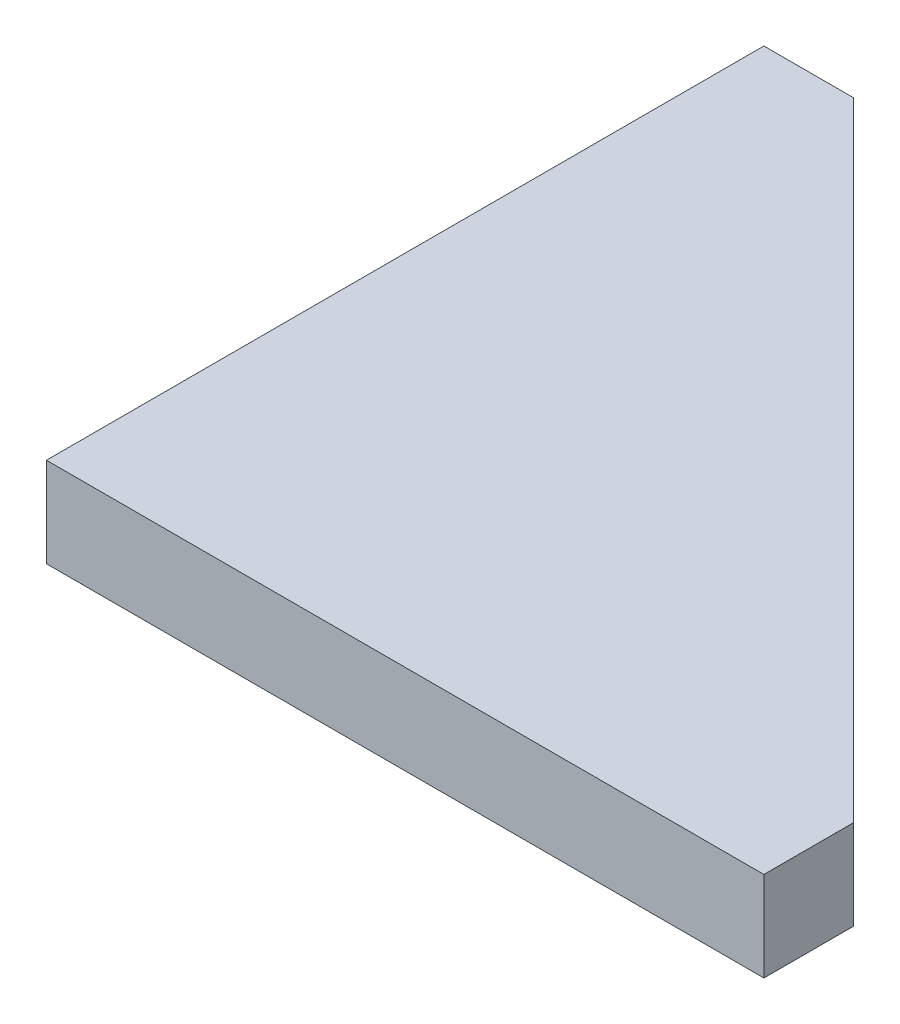
from build123d import *

# Parameters (mm, degrees)
SALIENTE_EXTRUIR1_DEPTH = 9.525
SALIENTE_EXTRUIR2_DEPTH = 9.525


with BuildPart() as part:
    # Croquis1 → Saliente-Extruir1 (new body)
    with BuildSketch(Plane(origin=(0, 0, 0), x_dir=(1, 0, 0), z_dir=(0, 1, 0))):
        Polygon((0, 0), (0, 76.2), (76.2, 0), align=None)
    extrude(amount=SALIENTE_EXTRUIR1_DEPTH)

    # Croquis2 → Saliente-Extruir2 (add)
    with BuildSketch(Plane(origin=(0, 9.525, 0), x_dir=(1, 0, 0), z_dir=(0, 1, 0))):
        Polygon((76.2, 0), (76.2, 9.525), (9.525, 76.2), (0, 76.2), align=None)
    extrude(amount=-SALIENTE_EXTRUIR2_DEPTH)


solid = part.part
